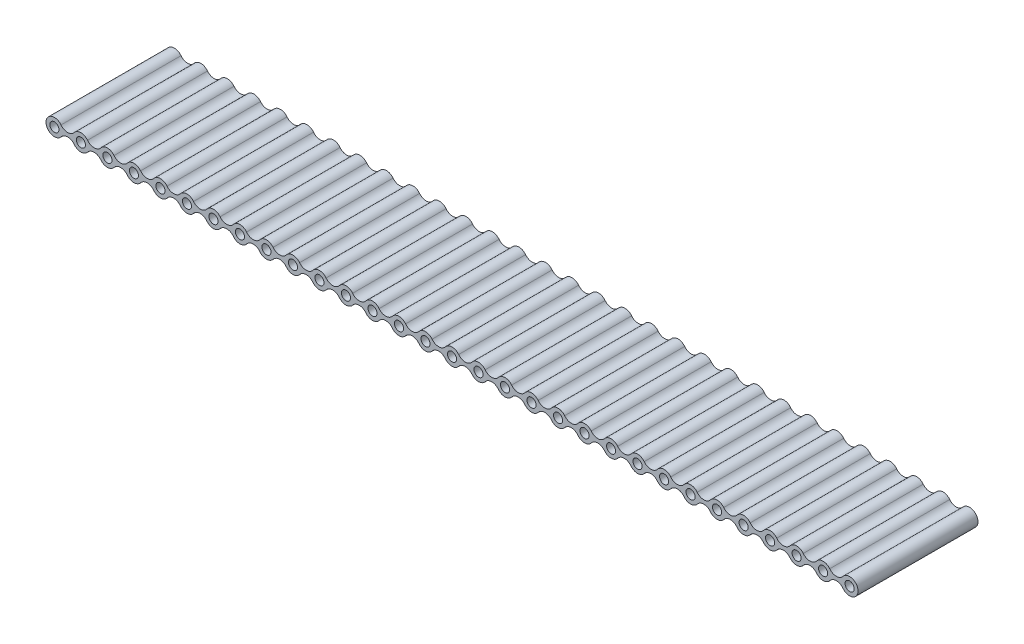
from build123d import *

# Parameters (mm, degrees)
SKETCH1_R           = 0.95
BOSS_EXTRUDE1_DEPTH = 25


with BuildPart() as part:
    # Sketch1 → Boss-Extrude1 (new body)
    with BuildSketch(Plane.XY):
        with BuildLine():
            ThreePointArc((1.380896448, 1.075), (-1.75, 0), (1.380896448, -1.075))
            ThreePointArc((1.380896448, -1.075), (2.761792896, -0.4), (4.142689344, -1.075))
            ThreePointArc((4.142689344, -1.075), (5.523585792, -1.75), (6.90448224, -1.075))
            ThreePointArc((6.90448224, -1.075), (8.285378688, -0.4), (9.666275136, -1.075))
            ThreePointArc((9.666275136, -1.075), (11.047171584, -1.75), (12.428068032, -1.075))
            ThreePointArc((12.428068032, -1.075), (13.80896448, -0.4), (15.189860928, -1.075))
            ThreePointArc((15.189860928, -1.075), (16.570757376, -1.75), (17.951653824, -1.075))
            ThreePointArc((17.951653824, -1.075), (19.332550271, -0.4), (20.713446719, -1.075))
            ThreePointArc((20.713446719, -1.075), (22.094343167, -1.75), (23.475239615, -1.075))
            ThreePointArc((23.475239615, -1.075), (24.856136063, -0.4), (26.237032511, -1.075))
            ThreePointArc((26.237032511, -1.075), (27.617928959, -1.75), (28.998825407, -1.075))
            ThreePointArc((28.998825407, -1.075), (30.379721855, -0.4), (31.760618303, -1.075))
            ThreePointArc((31.760618303, -1.075), (33.141514751, -1.75), (34.522411199, -1.075))
            ThreePointArc((34.522411199, -1.075), (35.903307647, -0.4), (37.284204095, -1.075))
            ThreePointArc((37.284204095, -1.075), (38.665100543, -1.75), (40.045996991, -1.075))
            ThreePointArc((40.045996991, -1.075), (41.426893439, -0.4), (42.807789887, -1.075))
            ThreePointArc((42.807789887, -1.075), (44.188686335, -1.75), (45.569582783, -1.075))
            ThreePointArc((45.569582783, -1.075), (46.950479231, -0.4), (48.331375679, -1.075))
            ThreePointArc((48.331375679, -1.075), (49.712272127, -1.75), (51.093168575, -1.075))
            ThreePointArc((51.093168575, -1.075), (52.474065023, -0.4), (53.854961471, -1.075))
            ThreePointArc((53.854961471, -1.075), (55.235857919, -1.75), (56.616754367, -1.075))
            ThreePointArc((56.616754367, -1.075), (57.997650814, -0.4), (59.378547262, -1.075))
            ThreePointArc((59.378547262, -1.075), (60.75944371, -1.75), (62.140340158, -1.075))
            ThreePointArc((62.140340158, -1.075), (63.521236606, -0.4), (64.902133054, -1.075))
            ThreePointArc((64.902133054, -1.075), (66.283029502, -1.75), (67.66392595, -1.075))
            ThreePointArc((67.66392595, -1.075), (69.044822398, -0.4), (70.425718846, -1.075))
            ThreePointArc((70.425718846, -1.075), (71.806615294, -1.75), (73.187511742, -1.075))
            ThreePointArc((73.187511742, -1.075), (74.56840819, -0.4), (75.949304638, -1.075))
            ThreePointArc((75.949304638, -1.075), (77.330201086, -1.75), (78.711097534, -1.075))
            ThreePointArc((78.711097534, -1.075), (80.091993982, -0.4), (81.47289043, -1.075))
            ThreePointArc((81.47289043, -1.075), (82.853786878, -1.75), (84.234683326, -1.075))
            ThreePointArc((84.234683326, -1.075), (85.615579774, -0.4), (86.996476222, -1.075))
            ThreePointArc((86.996476222, -1.075), (88.37737267, -1.75), (89.758269118, -1.075))
            ThreePointArc((89.758269118, -1.075), (91.139165566, -0.4), (92.520062014, -1.075))
            ThreePointArc((92.520062014, -1.075), (93.900958462, -1.75), (95.28185491, -1.075))
            ThreePointArc((95.28185491, -1.075), (96.662751357, -0.4), (98.043647805, -1.075))
            ThreePointArc((98.043647805, -1.075), (99.424544253, -1.75), (100.805440701, -1.075))
            ThreePointArc((100.805440701, -1.075), (102.186337149, -0.4), (103.567233597, -1.075))
            ThreePointArc((103.567233597, -1.075), (104.948130045, -1.75), (106.329026493, -1.075))
            ThreePointArc((106.329026493, -1.075), (107.709922941, -0.4), (109.090819389, -1.075))
            ThreePointArc((109.090819389, -1.075), (110.471715837, -1.75), (111.852612285, -1.075))
            ThreePointArc((111.852612285, -1.075), (113.233508733, -0.4), (114.614405181, -1.075))
            ThreePointArc((114.614405181, -1.075), (115.995301629, -1.75), (117.376198077, -1.075))
            ThreePointArc((117.376198077, -1.075), (118.757094525, -0.4), (120.137990973, -1.075))
            ThreePointArc((120.137990973, -1.075), (121.518887421, -1.75), (122.899783869, -1.075))
            ThreePointArc((122.899783869, -1.075), (124.280680317, -0.4), (125.661576765, -1.075))
            ThreePointArc((125.661576765, -1.075), (127.042473213, -1.75), (128.423369661, -1.075))
            ThreePointArc((128.423369661, -1.075), (129.804266109, -0.4), (131.185162557, -1.075))
            ThreePointArc((131.185162557, -1.075), (132.566059005, -1.75), (133.946955453, -1.075))
            ThreePointArc((133.946955453, -1.075), (135.3278519, -0.4), (136.708748348, -1.075))
            ThreePointArc((136.708748348, -1.075), (138.089644796, -1.75), (139.470541244, -1.075))
            ThreePointArc((139.470541244, -1.075), (140.851437692, -0.4), (142.23233414, -1.075))
            ThreePointArc((142.23233414, -1.075), (143.613230588, -1.75), (144.994127036, -1.075))
            ThreePointArc((144.994127036, -1.075), (146.375023484, -0.4), (147.755919932, -1.075))
            ThreePointArc((147.755919932, -1.075), (149.13681638, -1.75), (150.517712828, -1.075))
            ThreePointArc((150.517712828, -1.075), (151.898609276, -0.4), (153.279505724, -1.075))
            ThreePointArc((153.279505724, -1.075), (154.660402172, -1.75), (156.04129862, -1.075))
            ThreePointArc((156.04129862, -1.075), (157.422195068, -0.4), (158.803091516, -1.075))
            ThreePointArc((158.803091516, -1.075), (160.183987964, -1.75), (161.564884412, -1.075))
            ThreePointArc((161.564884412, -1.075), (162.94578086, -0.4), (164.326677308, -1.075))
            ThreePointArc((164.326677308, -1.075), (165.608141478, -1.747172923), (166.957591899, -1.224726354))
            ThreePointArc((166.957591899, -1.224726354), (167.457573756, 0), (166.957591899, 1.224726354))
            ThreePointArc((166.957591899, 1.224726354), (165.608141478, 1.747172923), (164.326677308, 1.075))
            ThreePointArc((164.326677308, 1.075), (162.94578086, 0.4), (161.564884412, 1.075))
            ThreePointArc((161.564884412, 1.075), (160.183987964, 1.75), (158.803091516, 1.075))
            ThreePointArc((158.803091516, 1.075), (157.422195068, 0.4), (156.04129862, 1.075))
            ThreePointArc((156.04129862, 1.075), (154.660402172, 1.75), (153.279505724, 1.075))
            ThreePointArc((153.279505724, 1.075), (151.898609276, 0.4), (150.517712828, 1.075))
            ThreePointArc((150.517712828, 1.075), (149.13681638, 1.75), (147.755919932, 1.075))
            ThreePointArc((147.755919932, 1.075), (146.375023484, 0.4), (144.994127036, 1.075))
            ThreePointArc((144.994127036, 1.075), (143.613230588, 1.75), (142.23233414, 1.075))
            ThreePointArc((142.23233414, 1.075), (140.851437692, 0.4), (139.470541244, 1.075))
            ThreePointArc((139.470541244, 1.075), (138.089644796, 1.75), (136.708748348, 1.075))
            ThreePointArc((136.708748348, 1.075), (135.3278519, 0.4), (133.946955453, 1.075))
            ThreePointArc((133.946955453, 1.075), (132.566059005, 1.75), (131.185162557, 1.075))
            ThreePointArc((131.185162557, 1.075), (129.804266109, 0.4), (128.423369661, 1.075))
            ThreePointArc((128.423369661, 1.075), (127.042473213, 1.75), (125.661576765, 1.075))
            ThreePointArc((125.661576765, 1.075), (124.280680317, 0.4), (122.899783869, 1.075))
            ThreePointArc((122.899783869, 1.075), (121.518887421, 1.75), (120.137990973, 1.075))
            ThreePointArc((120.137990973, 1.075), (118.757094525, 0.4), (117.376198077, 1.075))
            ThreePointArc((117.376198077, 1.075), (115.995301629, 1.75), (114.614405181, 1.075))
            ThreePointArc((114.614405181, 1.075), (113.233508733, 0.4), (111.852612285, 1.075))
            ThreePointArc((111.852612285, 1.075), (110.471715837, 1.75), (109.090819389, 1.075))
            ThreePointArc((109.090819389, 1.075), (107.709922941, 0.4), (106.329026493, 1.075))
            ThreePointArc((106.329026493, 1.075), (104.948130045, 1.75), (103.567233597, 1.075))
            ThreePointArc((103.567233597, 1.075), (102.186337149, 0.4), (100.805440701, 1.075))
            ThreePointArc((100.805440701, 1.075), (99.424544253, 1.75), (98.043647805, 1.075))
            ThreePointArc((98.043647805, 1.075), (96.662751357, 0.4), (95.28185491, 1.075))
            ThreePointArc((95.28185491, 1.075), (93.900958462, 1.75), (92.520062014, 1.075))
            ThreePointArc((92.520062014, 1.075), (91.139165566, 0.4), (89.758269118, 1.075))
            ThreePointArc((89.758269118, 1.075), (88.37737267, 1.75), (86.996476222, 1.075))
            ThreePointArc((86.996476222, 1.075), (85.615579774, 0.4), (84.234683326, 1.075))
            ThreePointArc((84.234683326, 1.075), (82.853786878, 1.75), (81.47289043, 1.075))
            ThreePointArc((81.47289043, 1.075), (80.091993982, 0.4), (78.711097534, 1.075))
            ThreePointArc((78.711097534, 1.075), (77.330201086, 1.75), (75.949304638, 1.075))
            ThreePointArc((75.949304638, 1.075), (74.56840819, 0.4), (73.187511742, 1.075))
            ThreePointArc((73.187511742, 1.075), (71.806615294, 1.75), (70.425718846, 1.075))
            ThreePointArc((70.425718846, 1.075), (69.044822398, 0.4), (67.66392595, 1.075))
            ThreePointArc((67.66392595, 1.075), (66.283029502, 1.75), (64.902133054, 1.075))
            ThreePointArc((64.902133054, 1.075), (63.521236606, 0.4), (62.140340158, 1.075))
            ThreePointArc((62.140340158, 1.075), (60.75944371, 1.75), (59.378547262, 1.075))
            ThreePointArc((59.378547262, 1.075), (57.997650814, 0.4), (56.616754367, 1.075))
            ThreePointArc((56.616754367, 1.075), (55.235857919, 1.75), (53.854961471, 1.075))
            ThreePointArc((53.854961471, 1.075), (52.474065023, 0.4), (51.093168575, 1.075))
            ThreePointArc((51.093168575, 1.075), (49.712272127, 1.75), (48.331375679, 1.075))
            ThreePointArc((48.331375679, 1.075), (46.950479231, 0.4), (45.569582783, 1.075))
            ThreePointArc((45.569582783, 1.075), (44.188686335, 1.75), (42.807789887, 1.075))
            ThreePointArc((42.807789887, 1.075), (41.426893439, 0.4), (40.045996991, 1.075))
            ThreePointArc((40.045996991, 1.075), (38.665100543, 1.75), (37.284204095, 1.075))
            ThreePointArc((37.284204095, 1.075), (35.903307647, 0.4), (34.522411199, 1.075))
            ThreePointArc((34.522411199, 1.075), (33.141514751, 1.75), (31.760618303, 1.075))
            ThreePointArc((31.760618303, 1.075), (30.379721855, 0.4), (28.998825407, 1.075))
            ThreePointArc((28.998825407, 1.075), (27.617928959, 1.75), (26.237032511, 1.075))
            ThreePointArc((26.237032511, 1.075), (24.856136063, 0.4), (23.475239615, 1.075))
            ThreePointArc((23.475239615, 1.075), (22.094343167, 1.75), (20.713446719, 1.075))
            ThreePointArc((20.713446719, 1.075), (19.332550271, 0.4), (17.951653824, 1.075))
            ThreePointArc((17.951653824, 1.075), (16.570757376, 1.75), (15.189860928, 1.075))
            ThreePointArc((15.189860928, 1.075), (13.80896448, 0.4), (12.428068032, 1.075))
            ThreePointArc((12.428068032, 1.075), (11.047171584, 1.75), (9.666275136, 1.075))
            ThreePointArc((9.666275136, 1.075), (8.285378688, 0.4), (6.90448224, 1.075))
            ThreePointArc((6.90448224, 1.075), (5.523585792, 1.75), (4.142689344, 1.075))
            ThreePointArc((4.142689344, 1.075), (2.761792896, 0.4), (1.380896448, 1.075))
        make_face()
        Circle(SKETCH1_R, mode=Mode.SUBTRACT)
        with Locations((5.523585792, 0)):
            Circle(SKETCH1_R, mode=Mode.SUBTRACT)
        with Locations((11.047171584, 0)):
            Circle(SKETCH1_R, mode=Mode.SUBTRACT)
        with Locations((16.570757376, 0)):
            Circle(SKETCH1_R, mode=Mode.SUBTRACT)
        with Locations((22.094343167, 0)):
            Circle(SKETCH1_R, mode=Mode.SUBTRACT)
        with Locations((27.617928959, 0)):
            Circle(SKETCH1_R, mode=Mode.SUBTRACT)
        with Locations((33.141514751, 0)):
            Circle(SKETCH1_R, mode=Mode.SUBTRACT)
        with Locations((38.665100543, 0)):
            Circle(SKETCH1_R, mode=Mode.SUBTRACT)
        with Locations((44.188686335, 0)):
            Circle(SKETCH1_R, mode=Mode.SUBTRACT)
        with Locations((49.712272127, 0)):
            Circle(SKETCH1_R, mode=Mode.SUBTRACT)
        with Locations((55.235857919, 0)):
            Circle(SKETCH1_R, mode=Mode.SUBTRACT)
        with Locations((60.75944371, 0)):
            Circle(SKETCH1_R, mode=Mode.SUBTRACT)
        with Locations((66.283029502, 0)):
            Circle(SKETCH1_R, mode=Mode.SUBTRACT)
        with Locations((71.806615294, 0)):
            Circle(SKETCH1_R, mode=Mode.SUBTRACT)
        with Locations((77.330201086, 0)):
            Circle(SKETCH1_R, mode=Mode.SUBTRACT)
        with Locations((82.853786878, 0)):
            Circle(SKETCH1_R, mode=Mode.SUBTRACT)
        with Locations((88.37737267, 0)):
            Circle(SKETCH1_R, mode=Mode.SUBTRACT)
        with Locations((93.900958462, 0)):
            Circle(SKETCH1_R, mode=Mode.SUBTRACT)
        with Locations((99.424544253, 0)):
            Circle(SKETCH1_R, mode=Mode.SUBTRACT)
        with Locations((104.948130045, 0)):
            Circle(SKETCH1_R, mode=Mode.SUBTRACT)
        with Locations((110.471715837, 0)):
            Circle(SKETCH1_R, mode=Mode.SUBTRACT)
        with Locations((115.995301629, 0)):
            Circle(SKETCH1_R, mode=Mode.SUBTRACT)
        with Locations((121.518887421, 0)):
            Circle(SKETCH1_R, mode=Mode.SUBTRACT)
        with Locations((127.042473213, 0)):
            Circle(SKETCH1_R, mode=Mode.SUBTRACT)
        with Locations((132.566059005, 0)):
            Circle(SKETCH1_R, mode=Mode.SUBTRACT)
        with Locations((138.089644796, 0)):
            Circle(SKETCH1_R, mode=Mode.SUBTRACT)
        with Locations((143.613230588, 0)):
            Circle(SKETCH1_R, mode=Mode.SUBTRACT)
        with Locations((149.13681638, 0)):
            Circle(SKETCH1_R, mode=Mode.SUBTRACT)
        with Locations((154.660402172, 0)):
            Circle(SKETCH1_R, mode=Mode.SUBTRACT)
        with Locations((160.183987964, 0)):
            Circle(SKETCH1_R, mode=Mode.SUBTRACT)
        with Locations((165.707573756, 0)):
            Circle(SKETCH1_R, mode=Mode.SUBTRACT)
    extrude(amount=BOSS_EXTRUDE1_DEPTH)


solid = part.part
